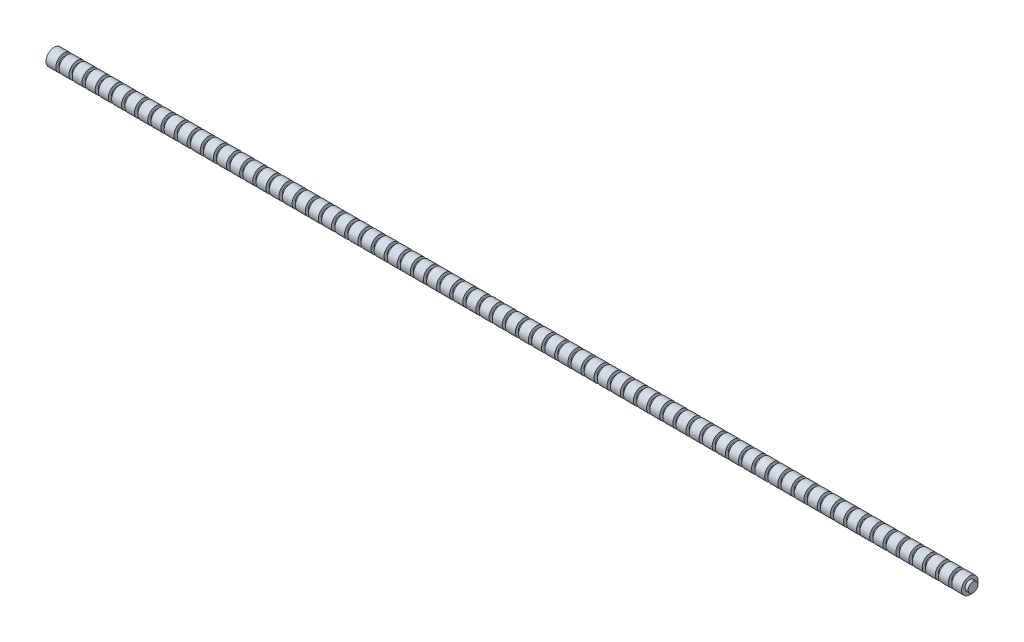
from build123d import *

# Parameters (mm, degrees)
SKETCH1_R           = 3.175
BOSS_EXTRUDE1_DEPTH = 381
CUT_EXTRUDE1_START  = -1.27
SKETCH2_R           = 3.175
SKETCH2_R_2         = 1.905
CUT_EXTRUDE1_DEPTH  = 1.27
LPATTERN1_COUNT     = 76
LPATTERN1_PITCH     = 5.08
CUT_EXTRUDE2_START  = -25.4
SKETCH4_R           = 3.175
CUT_EXTRUDE2_DEPTH  = 25.4


with BuildPart() as part:
    # Sketch1 → Boss-Extrude1 (new body)
    with BuildSketch(Plane(origin=(0, 0, 0), x_dir=(0, 0, -1), z_dir=(1, 0, 0))):
        Circle(SKETCH1_R)
    extrude(amount=BOSS_EXTRUDE1_DEPTH)

    # Sketch2 → Cut-Extrude1 (cut)
    with BuildSketch(Plane(origin=(381, 0, 0), x_dir=(0, 0, -1), z_dir=(1, 0, 0)).offset(CUT_EXTRUDE1_START)):
        Circle(SKETCH2_R)
        Circle(SKETCH2_R_2, mode=Mode.SUBTRACT)
    cut_extrude1 = extrude(amount=CUT_EXTRUDE1_DEPTH, mode=Mode.SUBTRACT)

    # LPattern1: Cut-Extrude1 ×76
    with Locations(*[(-i * LPATTERN1_PITCH, 0, 0) for i in range(1, LPATTERN1_COUNT)]):
        add(cut_extrude1, mode=Mode.SUBTRACT)

    # Sketch4 → Cut-Extrude2 (cut)
    with BuildSketch(Plane(origin=(381, 0, 0), x_dir=(0, 0, -1), z_dir=(1, 0, 0)).offset(CUT_EXTRUDE2_START)):
        Circle(SKETCH4_R)
    extrude(amount=CUT_EXTRUDE2_DEPTH, mode=Mode.SUBTRACT)


solid = part.part
